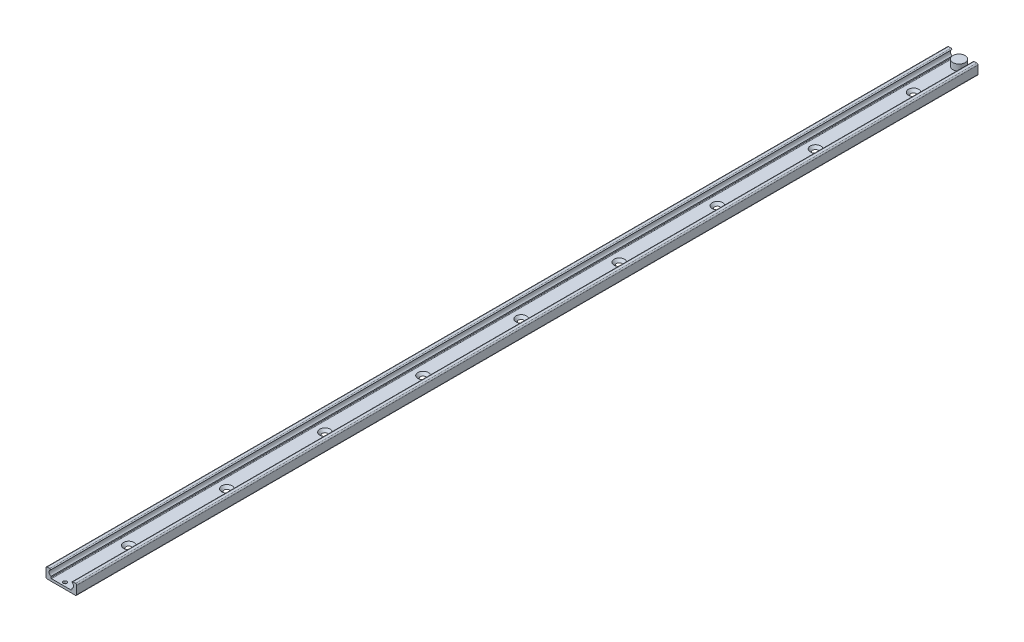
from build123d import *

# Parameters (mm, degrees)
EXTRUDE_1_DEPTH          = 720
SKETCH_3_R               = 5
EXTRUDE_3_DEPTH          = 5
HOLE_WIZARD_1_AT_2_COUNT = 2
HOLE_WIZARD_1_AT_2_PITCH = 640
HOLE_WIZARD_1_AT_3_COUNT = 2
HOLE_WIZARD_1_AT_3_PITCH = 560
HOLE_WIZARD_1_AT_4_COUNT = 2
HOLE_WIZARD_1_AT_4_PITCH = 480
HOLE_WIZARD_1_AT_5_COUNT = 2
HOLE_WIZARD_1_AT_5_PITCH = 400
HOLE_WIZARD_1_AT_6_COUNT = 2
HOLE_WIZARD_1_AT_6_PITCH = 320
HOLE_WIZARD_1_AT_7_COUNT = 2
HOLE_WIZARD_1_AT_7_PITCH = 240
HOLE_WIZARD_1_AT_8_COUNT = 2
HOLE_WIZARD_1_AT_8_PITCH = 160
HOLE_WIZARD_1_AT_9_COUNT = 2
HOLE_WIZARD_1_AT_9_PITCH = 80
FILLET_1_R               = 0.5
FILLET_2_R               = 1
EXTRUDE_4_DEPTH          = 15
SKETCH_7_R               = 1.5
CUT_EXTRUDE_1_DEPTH      = 736.135021612


with BuildPart() as part:
    # ｽｹｯﾁ1 → ﾎﾞｽ - 押し出し1 (new body)
    with BuildSketch(Plane.XY.offset(720)):
        with BuildLine():
            Line((8.5, 3.408712153), (8.5, 2))
            Line((8.5, 2), (-8.5, 2))
            Line((-8.5, 2), (-8.5, 3.408712153))
            ThreePointArc((-8.5, 3.408712153), (-9.999347871, 5.642901666), (-8.603592403, 7.943230663))
            ThreePointArc((-8.603592403, 7.943230663), (-8.97237829, 8.349479447), (-9.5, 8.5))
            Line((-9.5, 8.5), (-12.5, 8.5))
            Line((-12.5, 8.5), (-12.5, 0))
            Line((-12.5, 0), (12.5, 0))
            Line((12.5, 0), (12.5, 8.5))
            Line((12.5, 8.5), (9.5, 8.5))
            ThreePointArc((9.5, 8.5), (8.97237829, 8.349479447), (8.603592403, 7.943230663))
            ThreePointArc((8.603592403, 7.943230663), (9.999347871, 5.642901666), (8.5, 3.408712153))
        make_face()
    extrude(amount=-EXTRUDE_1_DEPTH)

    # ｽｹｯﾁ3 → ﾎﾞｽ - 押し出し3 (add)
    with BuildSketch(Plane(origin=(0, 2, 0), x_dir=(-1, 0, 0), z_dir=(0, 1, 0))):
        with Locations(Location((0, 3, 0), (0, 0, 323.130102354))):
            Circle(SKETCH_3_R)
    extrude(amount=EXTRUDE_3_DEPTH)

    # ｽｹｯﾁ4 → 穴1 (revolve, cut)
    with BuildSketch(Plane(origin=(0, 2, 40), x_dir=(0, 0, 1), z_dir=(1, 0, 0))):
        Polygon((0, 0), (0, 2), (2.25, 2), (4.25, 0), align=None)
    hole_wizard_1 = revolve(axis=Axis((0, -108, 40), (0, 1, 0)), mode=Mode.SUBTRACT)

    # 穴1 at 2: 穴1 ×2
    with Locations(*[(0, 0, i * HOLE_WIZARD_1_AT_2_PITCH) for i in range(1, HOLE_WIZARD_1_AT_2_COUNT)]):
        add(hole_wizard_1, mode=Mode.SUBTRACT)

    # 穴1 at 3: 穴1 ×2
    with Locations(*[(0, 0, i * HOLE_WIZARD_1_AT_3_PITCH) for i in range(1, HOLE_WIZARD_1_AT_3_COUNT)]):
        add(hole_wizard_1, mode=Mode.SUBTRACT)

    # 穴1 at 4: 穴1 ×2
    with Locations(*[(0, 0, i * HOLE_WIZARD_1_AT_4_PITCH) for i in range(1, HOLE_WIZARD_1_AT_4_COUNT)]):
        add(hole_wizard_1, mode=Mode.SUBTRACT)

    # 穴1 at 5: 穴1 ×2
    with Locations(*[(0, 0, i * HOLE_WIZARD_1_AT_5_PITCH) for i in range(1, HOLE_WIZARD_1_AT_5_COUNT)]):
        add(hole_wizard_1, mode=Mode.SUBTRACT)

    # 穴1 at 6: 穴1 ×2
    with Locations(*[(0, 0, i * HOLE_WIZARD_1_AT_6_PITCH) for i in range(1, HOLE_WIZARD_1_AT_6_COUNT)]):
        add(hole_wizard_1, mode=Mode.SUBTRACT)

    # 穴1 at 7: 穴1 ×2
    with Locations(*[(0, 0, i * HOLE_WIZARD_1_AT_7_PITCH) for i in range(1, HOLE_WIZARD_1_AT_7_COUNT)]):
        add(hole_wizard_1, mode=Mode.SUBTRACT)

    # 穴1 at 8: 穴1 ×2
    with Locations(*[(0, 0, i * HOLE_WIZARD_1_AT_8_PITCH) for i in range(1, HOLE_WIZARD_1_AT_8_COUNT)]):
        add(hole_wizard_1, mode=Mode.SUBTRACT)

    # 穴1 at 9: 穴1 ×2
    with Locations(*[(0, 0, i * HOLE_WIZARD_1_AT_9_PITCH) for i in range(1, HOLE_WIZARD_1_AT_9_COUNT)]):
        add(hole_wizard_1, mode=Mode.SUBTRACT)

    # ﾌｨﾚｯﾄ1
    fillet_1_edges = [part.edges().sort_by_distance(p)[0] for p in [
        (-8.5, 2, 360),
        (8.5, 2, 360),
    ]]
    fillet(fillet_1_edges, radius=FILLET_1_R)

    # ﾌｨﾚｯﾄ2
    fillet_2_edges = [part.edges().sort_by_distance(p)[0] for p in [
        (12.5, 8.5, 360),
        (12.5, 0, 360),
        (-12.5, 0, 360),
        (-12.5, 8.5, 360),
    ]]
    fillet(fillet_2_edges, radius=FILLET_2_R)

    # ｽｹｯﾁ6 → ﾎﾞｽ - 押し出し4 (add)
    with BuildSketch(Plane.XY.offset(720)):
        with BuildLine():
            ThreePointArc((-12.5, 1), (-12.207106781, 0.292893219), (-11.5, 0))
            Line((-11.5, 0), (11.5, 0))
            ThreePointArc((11.5, 0), (12.207106781, 0.292893219), (12.5, 1))
            Line((12.5, 1), (12.5, 7.5))
            ThreePointArc((12.5, 7.5), (12.207106781, 8.207106781), (11.5, 8.5))
            Line((11.5, 8.5), (9.5, 8.5))
            ThreePointArc((9.5, 8.5), (8.97237829, 8.349479447), (8.603592403, 7.943230663))
            ThreePointArc((8.603592403, 7.943230663), (9.999347871, 5.642901666), (8.5, 3.408712153))
            Line((8.5, 3.408712153), (8.5, 2.5))
            ThreePointArc((8.5, 2.5), (8.353553391, 2.146446609), (8, 2))
            Line((8, 2), (-8, 2))
            ThreePointArc((-8, 2), (-8.353553391, 2.146446609), (-8.5, 2.5))
            Line((-8.5, 2.5), (-8.5, 3.408712153))
            ThreePointArc((-8.5, 3.408712153), (-9.999347871, 5.642901666), (-8.603592403, 7.943230663))
            ThreePointArc((-8.603592403, 7.943230663), (-8.97237829, 8.349479447), (-9.5, 8.5))
            Line((-9.5, 8.5), (-11.5, 8.5))
            ThreePointArc((-11.5, 8.5), (-12.207106781, 8.207106781), (-12.5, 7.5))
            Line((-12.5, 7.5), (-12.5, 1))
        make_face()
    extrude(amount=EXTRUDE_4_DEPTH)

    # ｽｹｯﾁ7 → ｶｯﾄ - 押し出し1 (cut, through all)
    with BuildSketch(Plane(origin=(0, 2, 0), x_dir=(1, 0, 0), z_dir=(0, 1, 0))):
        with Locations(Location((0, -732, 0), (0, 0, 270))):
            Circle(SKETCH_7_R)
    extrude(amount=-CUT_EXTRUDE_1_DEPTH, mode=Mode.SUBTRACT)


solid = part.part
